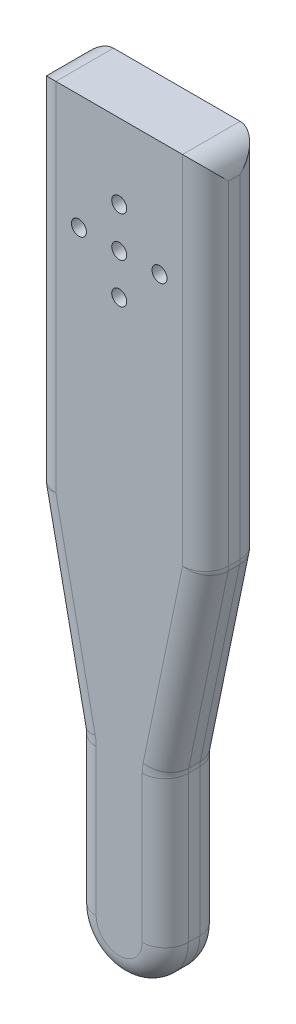
from build123d import *

# Parameters (mm, degrees)
SKETCH2_W           = 30
SKETCH2_H           = 130
BOSS_EXTRUDE1_DEPTH = 10
CUT_EXTRUDE3_DEPTH  = 75.64013832
FILLET3_RADIUS      = 8
FILLET3_LENGTH      = 10
FILLET4_R           = 4
SKETCH3_R           = 1.3
CUT_EXTRUDE4_DEPTH  = 75.64013841


with BuildPart() as part:
    # Sketch2 → Boss-Extrude1 (new body)
    with BuildSketch(Plane.XY):
        with Locations((-14.802371542, -2.697628458)):
            Rectangle(SKETCH2_W, SKETCH2_H)
    extrude(amount=BOSS_EXTRUDE1_DEPTH)

    # Sketch6 → Cut-Extrude3 (cut, through all)
    with BuildSketch(Plane.XY.offset(10)):
        Polygon((-29.802371542, -67.697628458), (-22.802371542, -67.697628458), (-22.802371542, -33.848814229), (-29.802371542, 0), align=None)
        Polygon((0.197628458, -67.697628458), (-6.802371542, -67.697628458), (-6.802371542, -33.848814229), (0.197628458, 0), align=None)
    extrude(amount=-CUT_EXTRUDE3_DEPTH, mode=Mode.SUBTRACT)

    # Fillet3: full round fillet: the end face becomes a half cylinder, R = half its width
    fillet3_face = Plane((-14.802371542, -67.697628458, 5), x_dir=(0, 0, 1), z_dir=(0, -1, 0))  # on the end face: x along it, z out of the body
    fillet3_slab = fillet3_face.offset(-FILLET3_RADIUS / 2) * Box(FILLET3_LENGTH, 2 * FILLET3_RADIUS, FILLET3_RADIUS, mode=Mode.PRIVATE)  # the body's end, R deep
    fillet3_round = Plane((-14.802371542, -59.697628458, 5), x_dir=(0, -1, 0), z_dir=(0, 0, 1)) * Cylinder(FILLET3_RADIUS, FILLET3_LENGTH, mode=Mode.PRIVATE)  # its axis R under the face
    add(fillet3_slab - fillet3_round, mode=Mode.SUBTRACT)

    # Fillet4
    fillet4_edges = [part.edges().sort_by_distance(p)[0] for p in [
        (0.197628458, 31.151185771, 0),
        (0.197628458, 31.151185771, 10),
        (-3.302371542, -16.924407115, 10),
        (-6.802371542, -33.848814229, 5),
        (0.197628458, 0, 5),
        (-3.302371542, -16.924407115, 0),
        (-26.302371542, -16.924407115, 10),
        (-29.802371542, 0, 5),
        (-22.802371542, -33.848814229, 5),
        (-26.302371542, -16.924407115, 0),
        (-22.802371542, -46.773221344, 10),
        (-22.802371542, -46.773221344, 0),
        (-6.802371542, -46.773221344, 10),
        (-6.802371542, -46.773221344, 0),
        (-14.802371542, -67.697628458, 0),
        (-14.802371542, -67.697628458, 10),
        (-29.802371542, 31.151185771, 10),
        (-29.802371542, 31.151185771, 0),
        (-29.802371542, 62.302371542, 5),
        (0.197628458, 62.302371542, 5),
    ]]
    fillet(fillet4_edges, radius=FILLET4_R)

    # Sketch3 → Cut-Extrude4 (cut, through all)
    with BuildSketch(Plane.XY.offset(10)):
        with Locations((-21.802371542, 42.302371542)):
            Circle(SKETCH3_R)
        with Locations((-14.802371542, 49.302371542)):
            Circle(SKETCH3_R)
        with Locations((-7.802371542, 42.302371542)):
            Circle(SKETCH3_R)
        with Locations((-14.802371542, 35.302371542)):
            Circle(SKETCH3_R)
        with Locations((-14.802371542, 42.302371542)):
            Circle(SKETCH3_R)
    extrude(amount=-CUT_EXTRUDE4_DEPTH, mode=Mode.SUBTRACT)


solid = part.part
